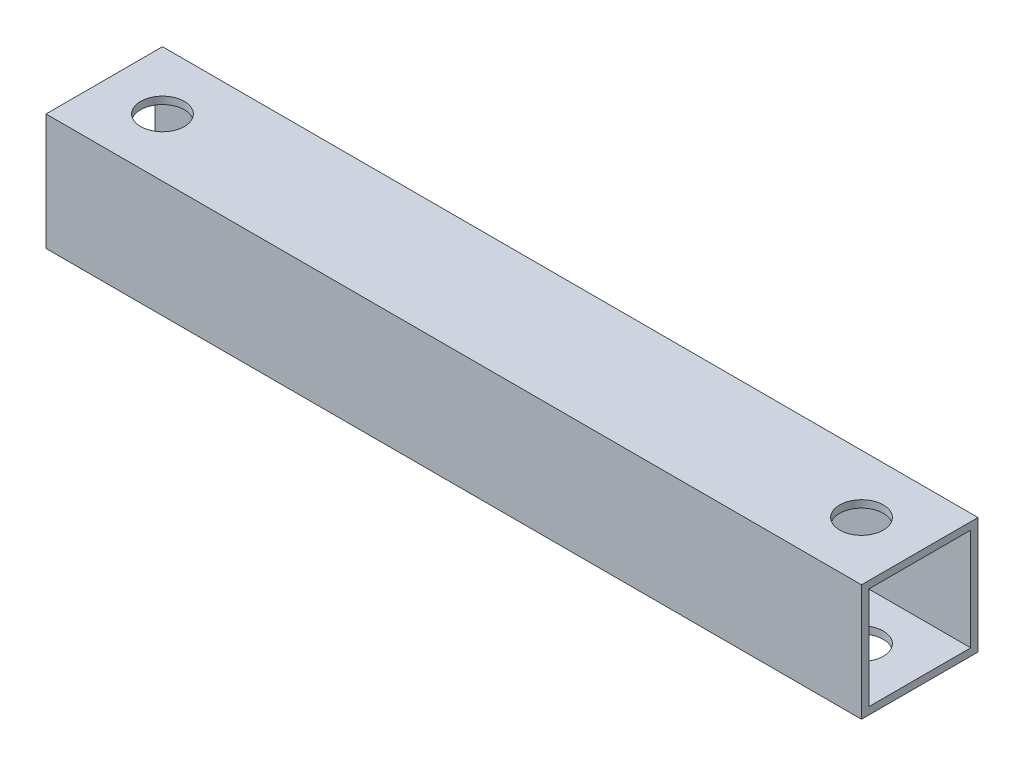
from build123d import *

# Parameters (mm, degrees)
SKETCH1_W           = 25.4
SKETCH1_H           = 25.4
SKETCH1_W_2         = 22.225
SKETCH1_H_2         = 22.225
BOSS_EXTRUDE1_DEPTH = 177.8
SKETCH2_R           = 4.7625
CUT_EXTRUDE1_DEPTH  = 181.05357536


with BuildPart() as part:
    # Sketch1 → Boss-Extrude1 (new body)
    with BuildSketch(Plane(origin=(0, 0, 0), x_dir=(0, 0, -1), z_dir=(1, 0, 0))):
        Rectangle(SKETCH1_W, SKETCH1_H)
        Rectangle(SKETCH1_W_2, SKETCH1_H_2, mode=Mode.SUBTRACT)
    extrude(amount=BOSS_EXTRUDE1_DEPTH)

    # Sketch2 → Cut-Extrude1 (cut, through all)
    with BuildSketch(Plane(origin=(0, 12.7, 0), x_dir=(1, 0, 0), z_dir=(0, 1, 0))):
        with Locations(Location((12.7, 0, 0), (0, 0, 270))):
            Circle(SKETCH2_R)
        with Locations(Location((165.1, 0, 0), (0, 0, 270))):
            Circle(SKETCH2_R)
    extrude(amount=-CUT_EXTRUDE1_DEPTH, mode=Mode.SUBTRACT)


solid = part.part
